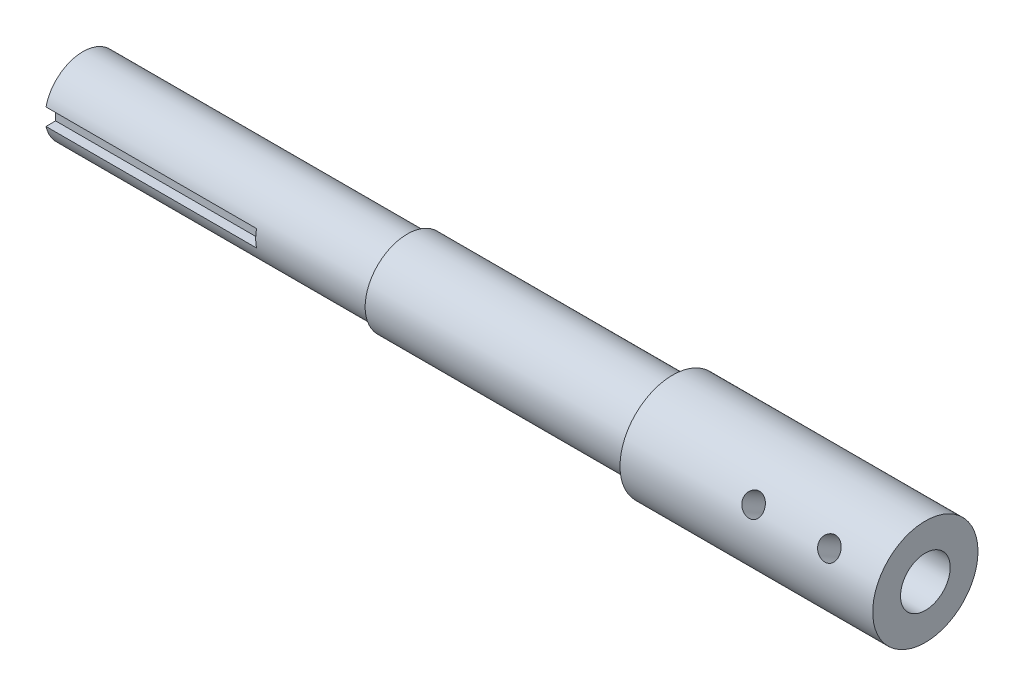
from build123d import *

# Parameters (mm, degrees)
SKETCH2_R           = 10
BOSS_EXTRUDE1_DEPTH = 63
SKETCH3_R           = 12.5
BOSS_EXTRUDE2_DEPTH = 60
SKETCH5_R           = 5.9
CUT_EXTRUDE1_DEPTH  = 40
SKETCH6_R           = 2.5
CUT_EXTRUDE2_DEPTH  = 55
CIRPATTERN1_COUNT   = 3
SKETCH8_R           = 9
BOSS_EXTRUDE3_DEPTH = 77
SKETCH9_W           = 3.883559786
SKETCH9_H           = 4
CUT_EXTRUDE3_DEPTH  = 50


with BuildPart() as part:
    # Sketch2 → Boss-Extrude1 (new body)
    with BuildSketch(Plane(origin=(0, 0, 0), x_dir=(0, 0, -1), z_dir=(1, 0, 0))):
        Circle(SKETCH2_R)
    extrude(amount=BOSS_EXTRUDE1_DEPTH)

    # Sketch3 → Boss-Extrude2 (add)
    with BuildSketch(Plane(origin=(63, 0, 0), x_dir=(0, 0, -1), z_dir=(1, 0, 0))):
        Circle(SKETCH3_R)
    extrude(amount=BOSS_EXTRUDE2_DEPTH)

    # Sketch5 → Cut-Extrude1 (cut)
    with BuildSketch(Plane(origin=(123, 0, 0), x_dir=(0, 0, -1), z_dir=(1, 0, 0))):
        Circle(SKETCH5_R)
    extrude(amount=-CUT_EXTRUDE1_DEPTH, mode=Mode.SUBTRACT)

    # Sketch6 → Cut-Extrude2 (cut)
    with BuildSketch(Plane(origin=(0, 0, 0), x_dir=(1, 0, 0), z_dir=(0, 1, 0))):
        with Locations(Location((93, 0, 0), (0, 0, 270))):
            Circle(SKETCH6_R)
        with Locations(Location((111, 0, 0), (0, 0, 270))):
            Circle(SKETCH6_R)
    cut_extrude2 = extrude(amount=-CUT_EXTRUDE2_DEPTH, mode=Mode.SUBTRACT)

    # CirPattern1: Cut-Extrude2 ×3 about axis
    cirpattern1_axis = Axis((123, 0, 0), (1, 0, 0))
    for i in range(1, CIRPATTERN1_COUNT):
        add(cut_extrude2.rotate(cirpattern1_axis, i * 360 / CIRPATTERN1_COUNT), mode=Mode.SUBTRACT)

    # Sketch8 → Boss-Extrude3 (add)
    with BuildSketch(Plane.ZY):
        with Locations(Location((0, 0, 0), (0, 0, 180))):
            Circle(SKETCH8_R)
    extrude(amount=BOSS_EXTRUDE3_DEPTH)

    # Sketch9 → Cut-Extrude3 (cut)
    with BuildSketch(Plane.ZY.offset(77)):
        with Locations((8.441779893, 0)):
            Rectangle(SKETCH9_W, SKETCH9_H)
    extrude(amount=-CUT_EXTRUDE3_DEPTH, mode=Mode.SUBTRACT)


solid = part.part
